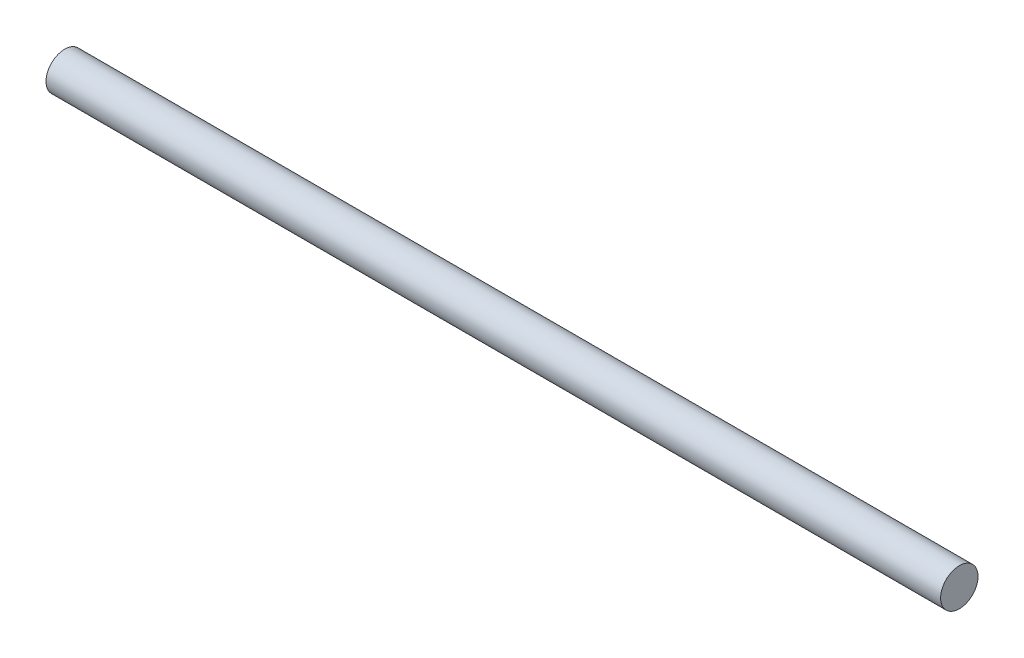
from build123d import *

# Parameters (mm, degrees)
SKETCH1_R           = 1.27
BOSS_EXTRUDE1_DEPTH = 60.7441


with BuildPart() as part:
    # Sketch1 → Boss-Extrude1 (new body)
    with BuildSketch(Plane(origin=(0, 0, 0), x_dir=(0, 0, -1), z_dir=(1, 0, 0))):
        with Locations(Location((0, 0, 0), (0, 0, 180))):
            Circle(SKETCH1_R)
    extrude(amount=BOSS_EXTRUDE1_DEPTH)


solid = part.part
